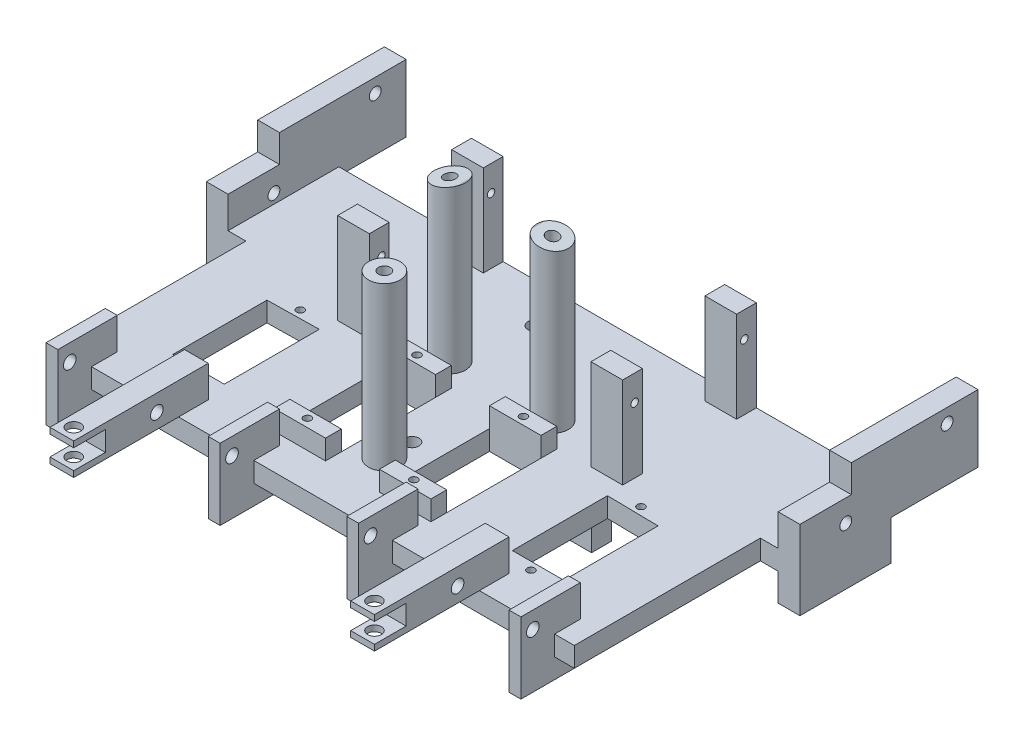
from build123d import *

# Parameters (mm, degrees)
SKETCH_1_W           = 130
SKETCH_1_H           = 75
EXTRUDE_1_DEPTH      = 5
SKETCH_4_W           = 139
SKETCH_4_H           = 28
EXTRUDE_4_DEPTH      = 5
SKETCH_5_W           = 23
SKETCH_5_H           = 20
EXTRUDE_5_DEPTH      = 5.5
SKETCH_6_W           = 32
SKETCH_6_H           = 17
EXTRUDE_6_DEPTH      = 5.5
SKETCH_8_W           = 8
SKETCH_8_H           = 5
EXTRUDE_7_DEPTH      = 23
EXTRUDE_START        = -10
SKETCH_9_W           = 3
SKETCH_9_H           = 15
EXTRUDE_8_DEPTH      = 18
SKETCH_10_W          = 3
SKETCH_10_H          = 15
EXTRUDE_9_DEPTH      = 18
SKETCH_11_W          = 6
SKETCH_11_H          = 34
EXTRUDE_10_DEPTH     = 8
SKETCH_12_R          = 4
EXTRUDE_11_DEPTH     = 41
CUT_EXTRUDE_8_REACH  = 133.69
SKETCH_19_R          = 0.95
SKETCH_25_R          = 4
EXTRUDE_14_DEPTH     = 41
CUT_EXTRUDE_14_DEPTH = 36
SKETCH_28_W          = 6
SKETCH_28_H          = 5
CUT_EXTRUDE_16_DEPTH = 8
SKETCH_29_R          = 1.75
CUT_EXTRUDE_17_DEPTH = 8
SKETCH_30_R          = 1.6
CUT_EXTRUDE_18_DEPTH = 48
SKETCH_31_R          = 1.75
CUT_EXTRUDE_19_DEPTH = 20
SKETCH_35_R          = 1.5
CUT_EXTRUDE_23_DEPTH = 15
SKETCH_36_R          = 0.95
SKETCH_36_W          = 13
SKETCH_36_H          = 23.8
CUT_EXTRUDE_24_DEPTH = 7
SKETCH_37_W          = 6
SKETCH_37_H          = 5
SKETCH_37_W_2        = 5.306431403
EXTRUDE_15_DEPTH     = 13
SKETCH_38_R          = 0.95
CUT_EXTRUDE_25_DEPTH = 13
SKETCH_43_W          = 37.306431403
SKETCH_43_H          = 36.541937829
SKETCH_43_W_2        = 5.306431403
SKETCH_43_H_2        = 5
SKETCH_43_W_3        = 6
CUT_EXTRUDE_28_DEPTH = 2
EXTRUDE_START_2      = 5
SKETCH_41_W          = 13
SKETCH_41_H          = 4
SKETCH_41_R          = 0.95
EXTRUDE_16_DEPTH     = 5
CUT_EXTRUDE_START    = -13
SKETCH_39_R          = 1.5
CUT_EXTRUDE_26_DEPTH = 55


with BuildPart() as part:
    # 草图1 → 凸台-拉伸1 (new body)
    with BuildSketch(Plane(origin=(0, 0, 0), x_dir=(1, 0, 0), z_dir=(0, 1, 0))):
        Rectangle(SKETCH_1_W, SKETCH_1_H)
    extrude(amount=EXTRUDE_1_DEPTH)

    # 草图4 → 凸台-拉伸4 (add)
    with BuildSketch(Plane(origin=(0, 5, 0), x_dir=(1, 0, 0), z_dir=(0, 1, 0))):
        with Locations((0, 23.5)):
            Rectangle(SKETCH_4_W, SKETCH_4_H)
    extrude(amount=-EXTRUDE_4_DEPTH)

    # 草图5 → 凸台-拉伸5 (add)
    with BuildSketch(Plane.ZY.offset(69.5)):
        with Locations((-21, 3)):
            Rectangle(SKETCH_5_W, SKETCH_5_H)
    extrude_5 = extrude(amount=EXTRUDE_5_DEPTH)

    # 草图6 → 凸台-拉伸6 (add)
    with BuildSketch(Plane.ZY.offset(69.5)):
        with Locations((-38.5, 11.5)):
            Rectangle(SKETCH_6_W, SKETCH_6_H)
    extrude_6 = extrude(amount=EXTRUDE_6_DEPTH)

    # 草图8 → 凸台-拉伸7 (add)
    with BuildSketch(Plane(origin=(0, 5, 0), x_dir=(1, 0, 0), z_dir=(0, 1, 0))):
        with Locations((-32, 35)):
            Rectangle(SKETCH_8_W, SKETCH_8_H)
        with Locations((-32, 6.2)):
            Rectangle(SKETCH_8_W, SKETCH_8_H)
    extrude_7 = extrude(amount=EXTRUDE_7_DEPTH)

    # 草图9 → 凸台-拉伸8 (add)
    with BuildSketch(Plane(origin=(0, 5, 0), x_dir=(1, 0, 0), z_dir=(0, 1, 0)).offset(EXTRUDE_START)):
        with Locations((-17.5, -38.5)):
            Rectangle(SKETCH_9_W, SKETCH_9_H)
    extrude_8 = extrude(amount=EXTRUDE_8_DEPTH)

    # 草图10 → 凸台-拉伸9 (add)
    with BuildSketch(Plane(origin=(0, 5, 0), x_dir=(1, 0, 0), z_dir=(0, 1, 0)).offset(EXTRUDE_START)):
        with Locations((-58.5, -38.5)):
            Rectangle(SKETCH_10_W, SKETCH_10_H)
    extrude_9 = extrude(amount=EXTRUDE_9_DEPTH)

    # 草图11 → 凸台-拉伸10 (add)
    with BuildSketch(Plane(origin=(0, 5, 0), x_dir=(1, 0, 0), z_dir=(0, 1, 0))):
        with Locations((-38, -47)):
            Rectangle(SKETCH_11_W, SKETCH_11_H)
    extrude_10 = extrude(amount=EXTRUDE_10_DEPTH)

    # 草图12 → 凸台-拉伸11 (add)
    with BuildSketch(Plane(origin=(0, 5, 0), x_dir=(1, 0, 0), z_dir=(0, 1, 0))):
        with Locations(Location((-13, 9, 0), (0, 0, 270))):
            Circle(SKETCH_12_R)
    extrude_11 = extrude(amount=EXTRUDE_11_DEPTH)

    # 草图19 → 切除-拉伸8 (cut, up to next)
    with BuildSketch(Plane.ZY.offset(36), mode=Mode.PRIVATE) as cut_extrude_8_sk1:
        with Locations((-6.75, 21.5)):
            Circle(SKETCH_19_R)
    cut_extrude_8_tool1 = extrude(cut_extrude_8_sk1.sketch, amount=-CUT_EXTRUDE_8_REACH, mode=Mode.PRIVATE) & part.part
    # 草图19 → 切除-拉伸8 (cut, up to next)
    with BuildSketch(Plane.ZY.offset(36), mode=Mode.PRIVATE) as cut_extrude_8_sk2:
        with Locations((-34.45, 21.5)):
            Circle(SKETCH_19_R)
    cut_extrude_8_tool2 = extrude(cut_extrude_8_sk2.sketch, amount=-CUT_EXTRUDE_8_REACH, mode=Mode.PRIVATE) & part.part
    cut_extrude_8_1 = cut_extrude_8_tool1.solids().sort_by_distance((-36, 21.5, -6.75))[0]
    add(cut_extrude_8_1, mode=Mode.SUBTRACT)
    cut_extrude_8_2 = cut_extrude_8_tool2.solids().sort_by_distance((-36, 21.5, -34.45))[0]
    add(cut_extrude_8_2, mode=Mode.SUBTRACT)
    cut_extrude_8 = cut_extrude_8_1 + cut_extrude_8_2  # 切除-拉伸8 as one shape, for the pattern or mirror that repeats it

    # 草图25 → 凸台-拉伸14 (add)
    with BuildSketch(Plane(origin=(0, 5, 0), x_dir=(1, 0, 0), z_dir=(0, 1, 0))):
        with Locations(Location((0, -20.5, 0), (0, 0, 270))):
            Circle(SKETCH_25_R)
    extrude_14 = extrude(amount=EXTRUDE_14_DEPTH)

    # 草图26 → 切除-拉伸14 (cut)
    with BuildSketch(Plane.XY):
        Polygon((-17, 46), (-17, 44.644045518), (-9.31, 46), align=None)
    cut_extrude_14 = extrude(amount=-CUT_EXTRUDE_14_DEPTH, mode=Mode.SUBTRACT)

    # 草图28 → 切除-拉伸16 (cut)
    with BuildSketch(Plane.XY.offset(64)):
        with Locations((-38, 9)):
            Rectangle(SKETCH_28_W, SKETCH_28_H)
    cut_extrude_16 = extrude(amount=-CUT_EXTRUDE_16_DEPTH, mode=Mode.SUBTRACT)

    # 草图29 → 切除-拉伸17 (cut)
    with BuildSketch(Plane(origin=(0, 13, 0), x_dir=(1, 0, 0), z_dir=(0, 1, 0))):
        with Locations(Location((-38, -61, 0), (0, 0, 270))):
            Circle(SKETCH_29_R)
    cut_extrude_17 = extrude(amount=-CUT_EXTRUDE_17_DEPTH, mode=Mode.SUBTRACT)

    # 草图30 → 切除-拉伸18 (cut)
    with BuildSketch(Plane.ZY.offset(60)):
        with Locations((43, 8.75)):
            Circle(SKETCH_30_R)
    cut_extrude_18 = extrude(amount=-CUT_EXTRUDE_18_DEPTH, mode=Mode.SUBTRACT)

    # 草图31 → 切除-拉伸19 (cut)
    with BuildSketch(Plane(origin=(0, 5, 0), x_dir=(1, 0, 0), z_dir=(0, 1, 0))):
        with Locations(Location((0, -13.5, 0), (0, 0, 270))):
            Circle(SKETCH_31_R)
        with Locations(Location((-10, 27.5, 0), (0, 0, 270))):
            Circle(SKETCH_31_R)
        with Locations(Location((10, 27.5, 0), (0, 0, 270))):
            Circle(SKETCH_31_R)
    cut_extrude_19 = extrude(amount=-CUT_EXTRUDE_19_DEPTH, mode=Mode.SUBTRACT)

    # 草图35 → 切除-拉伸23 (cut)
    with BuildSketch(Plane.ZY.offset(75)):
        with Locations((-46.688415906, 16.452713274)):
            Circle(SKETCH_35_R)
        with Locations((-21.089366767, 7.437765567)):
            Circle(SKETCH_35_R)
    cut_extrude_23 = extrude(amount=-CUT_EXTRUDE_23_DEPTH, mode=Mode.SUBTRACT)

    # 草图36 → 切除-拉伸24 (cut)
    with BuildSketch(Plane(origin=(0, 5, 0), x_dir=(1, 0, 0), z_dir=(0, 1, 0))):
        with Locations(Location((-13.450764078, 1.193623441, 0), (0, 0, 270))):
            Circle(SKETCH_36_R)
        with Locations(Location((-13.450764078, -26.506376559, 0), (0, 0, 270))):
            Circle(SKETCH_36_R)
        with Locations(Location((-43.042963744, -26.506376559, 0), (0, 0, 270))):
            Circle(SKETCH_36_R)
        with Locations(Location((-43.042149042, 1.299433183, 0), (0, 0, 270))):
            Circle(SKETCH_36_R)
        with Locations((-13.315810377, -12.656376559)):
            Rectangle(SKETCH_36_W, SKETCH_36_H)
        Polygon((-36.409173914, -0.540853807), (-36.409173914, -24.556376559), (-49.408008263, -24.556376559), (-49.407387251, -0.756376567), align=None)
    cut_extrude_24 = extrude(amount=-CUT_EXTRUDE_24_DEPTH, mode=Mode.SUBTRACT)

    # 草图37 → 凸台-拉伸15 (add)
    with BuildSketch(Plane.XZ):
        with Locations((-26.580190938, -34.258062171)):
            Rectangle(SKETCH_37_W, SKETCH_37_H)
        with Locations((-26.23340664, -5.458062171)):
            Rectangle(SKETCH_37_W_2, SKETCH_37_H)
    extrude_15 = extrude(amount=EXTRUDE_15_DEPTH)

    # 草图38 → 切除-拉伸25 (cut)
    with BuildSketch(Plane.ZY.offset(29.580190938)):
        with Locations((-33.708062171, -4.5)):
            Circle(SKETCH_38_R)
        with Locations((-6.008062171, -4.5)):
            Circle(SKETCH_38_R)
    cut_extrude_25 = extrude(amount=-CUT_EXTRUDE_25_DEPTH, mode=Mode.SUBTRACT)

    # 草图43 → 切除-拉伸28 (cut)
    with BuildSketch(Plane.XZ):
        with Locations((-34.23340664, -19.229031086)):
            Rectangle(SKETCH_43_W, SKETCH_43_H)
        with Locations((-26.23340664, -5.458062171)):
            Rectangle(SKETCH_43_W_2, SKETCH_43_H_2, mode=Mode.SUBTRACT)
        with Locations((-26.580190938, -34.258062171)):
            Rectangle(SKETCH_43_W_3, SKETCH_43_H_2, mode=Mode.SUBTRACT)
    cut_extrude_28 = extrude(amount=-CUT_EXTRUDE_28_DEPTH, mode=Mode.SUBTRACT)

    # 草图41 → 凸台-拉伸16 (add)
    # profile 1 of 2: a face of its own
    with BuildSketch(Plane(origin=(0, 5, 0), x_dir=(1, 0, 0), z_dir=(0, 1, 0)).offset(EXTRUDE_START_2)):
        with Locations((-13.315810377, 1.243623441)):
            Rectangle(SKETCH_41_W, SKETCH_41_H)
        with Locations(Location((-13.450764078, 1.193623441, 0), (0, 0, 270))):
            Circle(SKETCH_41_R, mode=Mode.SUBTRACT)
    # profile 2 of 2: a face of its own
    with BuildSketch(Plane(origin=(0, 5, 0), x_dir=(1, 0, 0), z_dir=(0, 1, 0)).offset(EXTRUDE_START_2)):
        with Locations((-13.315810377, -26.556376559)):
            Rectangle(SKETCH_41_W, SKETCH_41_H)
        with Locations(Location((-13.450764078, -26.506376559, 0), (0, 0, 270))):
            Circle(SKETCH_41_R, mode=Mode.SUBTRACT)
    extrude_16 = extrude(amount=-EXTRUDE_16_DEPTH)

    # 草图39 → 切除-拉伸26 (cut)
    with BuildSketch(Plane(origin=(0, 5, 0), x_dir=(1, 0, 0), z_dir=(0, 1, 0)).offset(CUT_EXTRUDE_START)):
        with Locations(Location((-13, 9, 0), (0, 0, 180))):
            Circle(SKETCH_39_R)
        with Locations(Location((0, -20.5, 0), (0, 0, 270))):
            Circle(SKETCH_39_R)
    cut_extrude_26 = extrude(amount=CUT_EXTRUDE_26_DEPTH, mode=Mode.SUBTRACT)

    # 镜向1: 凸台-拉伸5, 凸台-拉伸6, 凸台-拉伸7, 凸台-拉伸8, 凸台-拉伸9, 凸台-拉伸10, 凸台-拉伸11, 切除-拉伸8, 凸台-拉伸14, 切除-拉伸14, 切除-拉伸16, 切除-拉伸17, 切除-拉伸18, 切除-拉伸19, 切除-拉伸23, 切除-拉伸24, 凸台-拉伸15, 切除-拉伸25, 切除-拉伸28, 凸台-拉伸16, 切除-拉伸26 across plane
    add(extrude_5.mirror(Plane(origin=(0, 0, 0), x_dir=(0, 0, 1), z_dir=(1, 0, 0))))
    add(extrude_6.mirror(Plane(origin=(0, 0, 0), x_dir=(0, 0, 1), z_dir=(1, 0, 0))))
    add(extrude_7.mirror(Plane(origin=(0, 0, 0), x_dir=(0, 0, 1), z_dir=(1, 0, 0))))
    add(extrude_8.mirror(Plane(origin=(0, 0, 0), x_dir=(0, 0, 1), z_dir=(1, 0, 0))))
    add(extrude_9.mirror(Plane(origin=(0, 0, 0), x_dir=(0, 0, 1), z_dir=(1, 0, 0))))
    add(extrude_10.mirror(Plane(origin=(0, 0, 0), x_dir=(0, 0, 1), z_dir=(1, 0, 0))))
    add(extrude_11.mirror(Plane(origin=(0, 0, 0), x_dir=(0, 0, 1), z_dir=(1, 0, 0))))
    add(cut_extrude_8.mirror(Plane(origin=(0, 0, 0), x_dir=(0, 0, 1), z_dir=(1, 0, 0))), mode=Mode.SUBTRACT)
    add(extrude_14.mirror(Plane(origin=(0, 0, 0), x_dir=(0, 0, 1), z_dir=(1, 0, 0))))
    add(cut_extrude_14.mirror(Plane(origin=(0, 0, 0), x_dir=(0, 0, 1), z_dir=(1, 0, 0))), mode=Mode.SUBTRACT)
    add(cut_extrude_16.mirror(Plane(origin=(0, 0, 0), x_dir=(0, 0, 1), z_dir=(1, 0, 0))), mode=Mode.SUBTRACT)
    add(cut_extrude_17.mirror(Plane(origin=(0, 0, 0), x_dir=(0, 0, 1), z_dir=(1, 0, 0))), mode=Mode.SUBTRACT)
    add(cut_extrude_18.mirror(Plane(origin=(0, 0, 0), x_dir=(0, 0, 1), z_dir=(1, 0, 0))), mode=Mode.SUBTRACT)
    add(cut_extrude_19.mirror(Plane(origin=(0, 0, 0), x_dir=(0, 0, 1), z_dir=(1, 0, 0))), mode=Mode.SUBTRACT)
    add(cut_extrude_23.mirror(Plane(origin=(0, 0, 0), x_dir=(0, 0, 1), z_dir=(1, 0, 0))), mode=Mode.SUBTRACT)
    add(cut_extrude_24.mirror(Plane(origin=(0, 0, 0), x_dir=(0, 0, 1), z_dir=(1, 0, 0))), mode=Mode.SUBTRACT)
    add(extrude_15.mirror(Plane(origin=(0, 0, 0), x_dir=(0, 0, 1), z_dir=(1, 0, 0))))
    add(cut_extrude_25.mirror(Plane(origin=(0, 0, 0), x_dir=(0, 0, 1), z_dir=(1, 0, 0))), mode=Mode.SUBTRACT)
    add(cut_extrude_28.mirror(Plane(origin=(0, 0, 0), x_dir=(0, 0, 1), z_dir=(1, 0, 0))), mode=Mode.SUBTRACT)
    add(extrude_16.mirror(Plane(origin=(0, 0, 0), x_dir=(0, 0, 1), z_dir=(1, 0, 0))))
    add(cut_extrude_26.mirror(Plane(origin=(0, 0, 0), x_dir=(0, 0, 1), z_dir=(1, 0, 0))), mode=Mode.SUBTRACT)


solid = part.part
